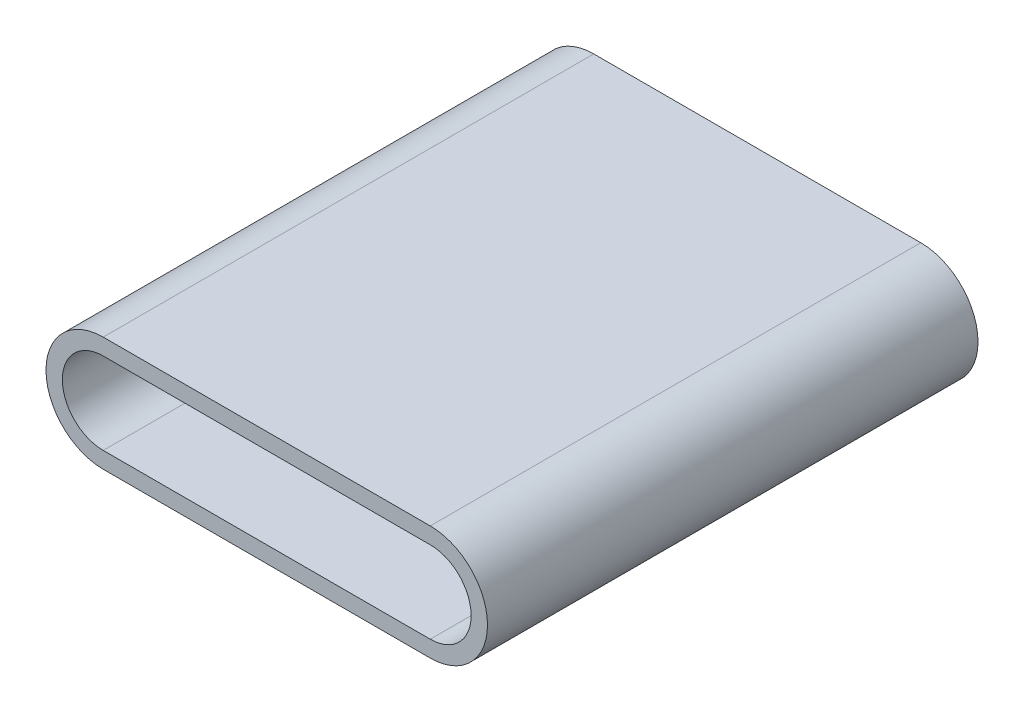
from build123d import *

# Parameters (mm, degrees)
BOSS_EXTRUDE1_DEPTH = 15


with BuildPart() as part:
    # Sketch2 → Boss-Extrude1 (new, symmetric)
    with BuildSketch(Plane.XY):
        with BuildLine():
            Line((-10, 3.5), (10, 3.5))
            ThreePointArc((10, 3.5), (13.5, 0), (10, -3.5))
            Line((10, -3.5), (-10, -3.5))
            ThreePointArc((-10, -3.5), (-13.5, 0), (-10, 3.5))
        make_face()
        with BuildLine():
            Line((-10, 2.5), (10, 2.5))
            ThreePointArc((10, 2.5), (12.5, 0), (10, -2.5))
            Line((10, -2.5), (-10, -2.5))
            ThreePointArc((-10, -2.5), (-12.5, 0), (-10, 2.5))
        make_face(mode=Mode.SUBTRACT)
    extrude(amount=BOSS_EXTRUDE1_DEPTH, both=True)


solid = part.part
